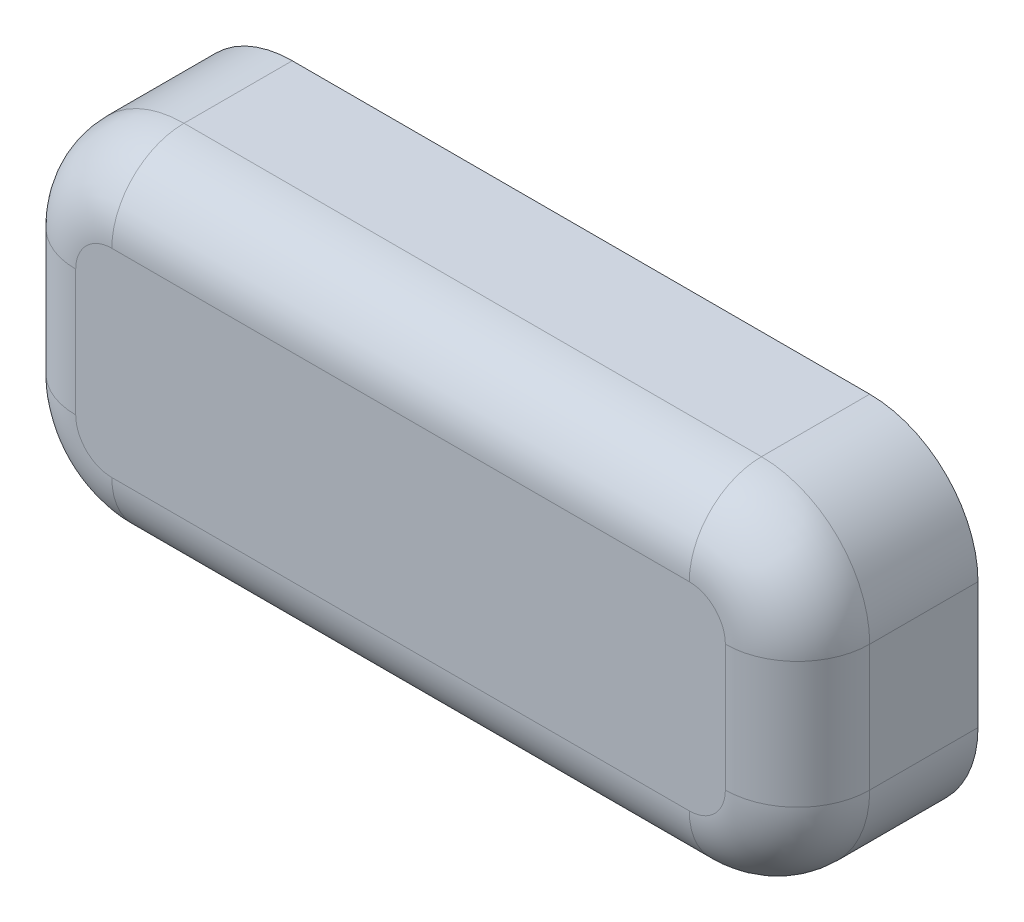
from build123d import *

# Parameters (mm, degrees)
SKETCH1_W           = 220
SKETCH1_H           = 95
BOSS_EXTRUDE1_DEPTH = 50
FILLET1_R           = 30
FILLET2_R           = 20
SHELL1_T            = -1.5


with BuildPart() as part:
    # Sketch1 → Boss-Extrude1 (new body)
    with BuildSketch(Plane.XY):
        with Locations((110, -47.5)):
            Rectangle(SKETCH1_W, SKETCH1_H)
    extrude(amount=BOSS_EXTRUDE1_DEPTH)

    # Fillet1
    fillet1_edges = [part.edges().sort_by_distance(p)[0] for p in [
        (0, 0, 25),
        (220, 0, 25),
        (220, -95, 25),
        (0, -95, 25),
    ]]
    fillet(fillet1_edges, radius=FILLET1_R)

    # Fillet2
    fillet2_edges = [part.edges().sort_by_distance(p)[0] for p in [
        (220, -47.5, 50),
        (110, -95, 50),
        (0, -47.5, 50),
        (110, 0, 50),
        (8.786796564, -8.786796564, 50),
        (8.786796564, -86.213203436, 50),
        (211.213203436, -8.786796564, 50),
        (211.213203436, -86.213203436, 50),
    ]]
    fillet(fillet2_edges, radius=FILLET2_R)

    # Shell1
    shell1_openings = [part.faces().sort_by_distance(p)[0] for p in [
        (110, -47.5, 0),
    ]]
    offset(amount=SHELL1_T, openings=shell1_openings, kind=Kind.INTERSECTION)


solid = part.part
